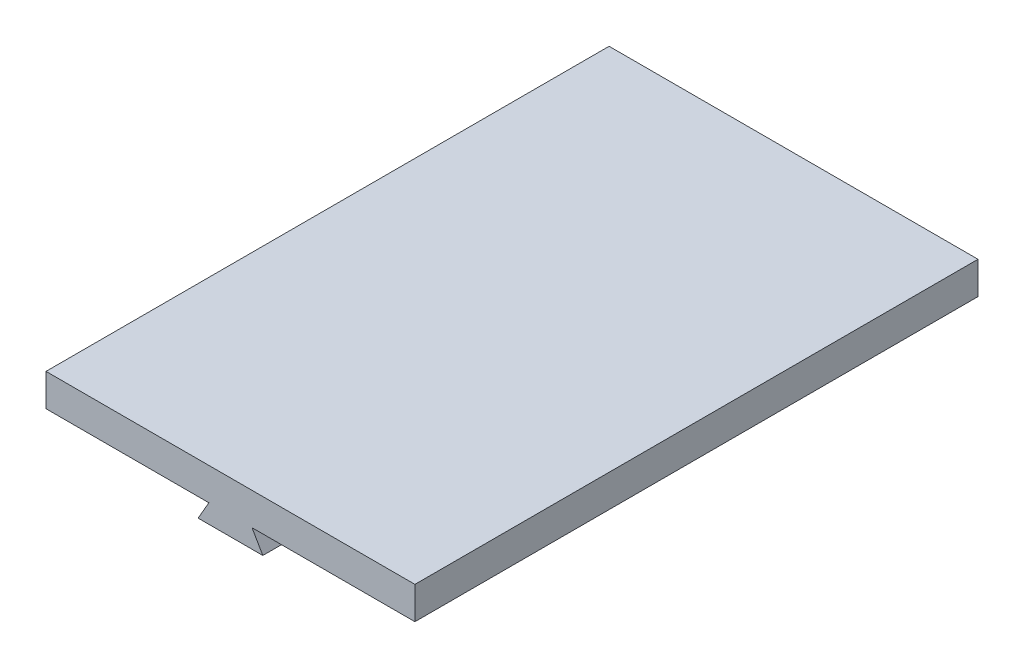
from build123d import *

# Parameters (mm, degrees)
SKETCH1_W           = 57
SKETCH1_H           = 87
BOSS_EXTRUDE1_DEPTH = 5
BOSS_EXTRUDE2_DEPTH = 5
BOSS_EXTRUDE3_START = -87
BOSS_EXTRUDE3_DEPTH = 5


with BuildPart() as part:
    # Sketch1 → Boss-Extrude1 (new body)
    with BuildSketch(Plane(origin=(0, 0, 0), x_dir=(1, 0, 0), z_dir=(0, 1, 0))):
        Rectangle(SKETCH1_W, SKETCH1_H)
    extrude(amount=BOSS_EXTRUDE1_DEPTH)

    # Sketch2 → Boss-Extrude2 (add)
    with BuildSketch(Plane.XY.offset(43.5)):
        Polygon((3.333333333, 0), (-3.333333333, 0), (-5, -2.886751346), (5, -2.886751346), align=None)
    extrude(amount=-BOSS_EXTRUDE2_DEPTH)

    # Sketch2<3> → Boss-Extrude3 (add)
    with BuildSketch(Plane.XY.offset(43.5).offset(BOSS_EXTRUDE3_START)):
        Polygon((3.333333333, 0), (-3.333333333, 0), (-5, -2.886751346), (5, -2.886751346), align=None)
    extrude(amount=BOSS_EXTRUDE3_DEPTH)


solid = part.part
